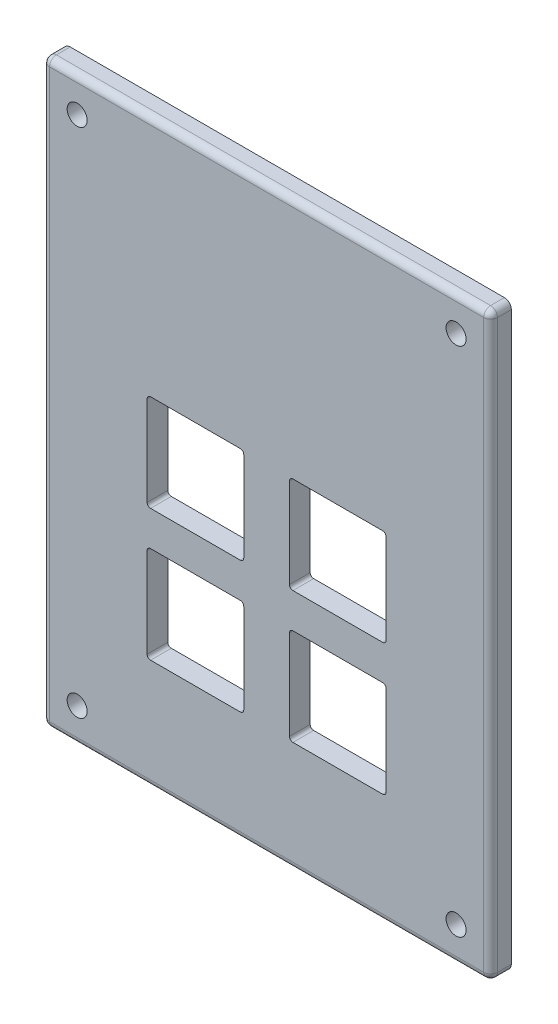
from build123d import *

# Parameters (mm, degrees)
MODEL_W            = 64.9
MODEL_H            = 84.15
MODEL_R            = 1.45
BOSS_EXTRU_2_DEPTH = 3
CONG_1_R           = 1
CONG_2_R           = 1
CONG_4_R           = 1
CONG_5_R           = 1


with BuildPart() as part:
    # Model → Boss.-Extru.2 (new body)
    with BuildSketch(Plane.XY):
        with Locations((19.8375, -9.525)):
            Rectangle(MODEL_W, MODEL_H)
        with Locations((-7.6125, 27.55)):
            Circle(MODEL_R, mode=Mode.SUBTRACT)
        with Locations((47.2875, 27.55)):
            Circle(MODEL_R, mode=Mode.SUBTRACT)
        with Locations((47.2875, -46.6)):
            Circle(MODEL_R, mode=Mode.SUBTRACT)
        with Locations((-7.6125, -46.6)):
            Circle(MODEL_R, mode=Mode.SUBTRACT)
        with BuildLine():
            Line((3.025, -2.525), (16.025, -2.525))
            ThreePointArc((16.025, -2.525), (16.378553391, -2.671446609), (16.525, -3.025))
            Line((16.525, -3.025), (16.525, -16.025))
            ThreePointArc((16.525, -16.025), (16.378553391, -16.378553391), (16.025, -16.525))
            Line((16.025, -16.525), (3.025, -16.525))
            ThreePointArc((3.025, -16.525), (2.671446609, -16.378553391), (2.525, -16.025))
            Line((2.525, -16.025), (2.525, -3.025))
            ThreePointArc((2.525, -3.025), (2.671446609, -2.671446609), (3.025, -2.525))
        make_face(mode=Mode.SUBTRACT)
        with BuildLine():
            Line((23.65, -2.525), (36.65, -2.525))
            ThreePointArc((36.65, -2.525), (37.003553391, -2.671446609), (37.15, -3.025))
            Line((37.15, -3.025), (37.15, -16.025))
            ThreePointArc((37.15, -16.025), (37.003553391, -16.378553391), (36.65, -16.525))
            Line((36.65, -16.525), (23.65, -16.525))
            ThreePointArc((23.65, -16.525), (23.296446609, -16.378553391), (23.15, -16.025))
            Line((23.15, -16.025), (23.15, -3.025))
            ThreePointArc((23.15, -3.025), (23.296446609, -2.671446609), (23.65, -2.525))
        make_face(mode=Mode.SUBTRACT)
        with BuildLine():
            Line((3.025, -21.575), (16.025, -21.575))
            ThreePointArc((16.025, -21.575), (16.378553391, -21.721446609), (16.525, -22.075))
            Line((16.525, -22.075), (16.525, -35.075))
            ThreePointArc((16.525, -35.075), (16.378553391, -35.428553391), (16.025, -35.575))
            Line((16.025, -35.575), (3.025, -35.575))
            ThreePointArc((3.025, -35.575), (2.671446609, -35.428553391), (2.525, -35.075))
            Line((2.525, -35.075), (2.525, -22.075))
            ThreePointArc((2.525, -22.075), (2.671446609, -21.721446609), (3.025, -21.575))
        make_face(mode=Mode.SUBTRACT)
        with BuildLine():
            Line((23.65, -21.575), (36.65, -21.575))
            ThreePointArc((36.65, -21.575), (37.003553391, -21.721446609), (37.15, -22.075))
            Line((37.15, -22.075), (37.15, -35.075))
            ThreePointArc((37.15, -35.075), (37.003553391, -35.428553391), (36.65, -35.575))
            Line((36.65, -35.575), (23.65, -35.575))
            ThreePointArc((23.65, -35.575), (23.296446609, -35.428553391), (23.15, -35.075))
            Line((23.15, -35.075), (23.15, -22.075))
            ThreePointArc((23.15, -22.075), (23.296446609, -21.721446609), (23.65, -21.575))
        make_face(mode=Mode.SUBTRACT)
    extrude(amount=BOSS_EXTRU_2_DEPTH)

    # Congé1
    cong_1_edges = [part.edges().sort_by_distance(p)[0] for p in [
        (-12.6125, -9.525, 3),
    ]]
    fillet(cong_1_edges, radius=CONG_1_R)

    # Congé2
    cong_2_edges = [part.edges().sort_by_distance(p)[0] for p in [
        (52.2875, -9.525, 3),
    ]]
    fillet(cong_2_edges, radius=CONG_2_R)

    # Congé4
    cong_4_edges = [part.edges().sort_by_distance(p)[0] for p in [
        (19.8375, -51.6, 3),
        (-12.6125, -51.6, 1),
        (-12.319606781, -51.6, 2.707106781),
        (52.2875, -51.6, 1),
        (51.994606781, -51.6, 2.707106781),
    ]]
    fillet(cong_4_edges, radius=CONG_4_R)

    # Congé5
    cong_5_edges = [part.edges().sort_by_distance(p)[0] for p in [
        (-12.6125, 32.55, 1),
        (-12.319606781, 32.55, 2.707106781),
        (19.8375, 32.55, 3),
        (52.2875, 32.55, 1),
        (51.994606781, 32.55, 2.707106781),
    ]]
    fillet(cong_5_edges, radius=CONG_5_R)


solid = part.part
